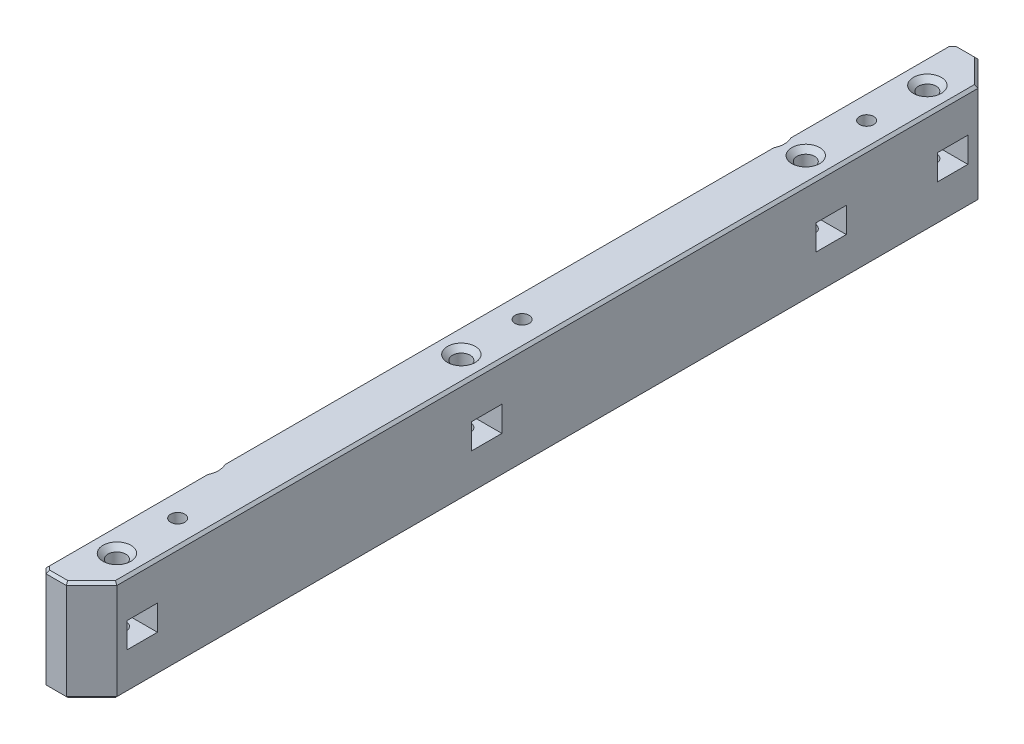
from build123d import *

# Parameters (mm, degrees)
SKETCH1_W           = 10
SKETCH1_H           = 20
BOSS_EXTRUDE1_DEPTH = 90
SKETCH6_R           = 1.75
CUT_EXTRUDE4_DEPTH  = 93.330926563
SKETCH7_R           = 1.4
CUT_EXTRUDE5_DEPTH  = 93.330926563
CUT_EXTRUDE6_START  = -10
CUT_EXTRUDE6_DEPTH  = 2.5
CHAMFER2_SIZE       = 5
CHAMFER3_SIZE       = 1
CHAMFER4_SIZE       = 0.5
CHAMFER5_SIZE       = 0.5
SKETCH10_R          = 3.75
CUT_EXTRUDE7_DEPTH  = 93.330926563


with BuildPart() as part:
    # Sketch1 → Boss-Extrude1 (new, symmetric)
    with BuildSketch(Plane.XY):
        Rectangle(SKETCH1_W, SKETCH1_H)
    extrude(amount=BOSS_EXTRUDE1_DEPTH, both=True)

    # Sketch6 → Cut-Extrude4 (cut, through all)
    with BuildSketch(Plane.XZ.offset(10)):
        with Locations((0, 80)):
            Circle(SKETCH6_R)
        with Locations((0, -80)):
            Circle(SKETCH6_R)
        with Locations((0, 12)):
            Circle(SKETCH6_R)
        with Locations((0, -56)):
            Circle(SKETCH6_R)
    extrude(amount=-CUT_EXTRUDE4_DEPTH, mode=Mode.SUBTRACT)

    # Sketch7 → Cut-Extrude5 (cut, through all)
    with BuildSketch(Plane(origin=(0, 10, 0), x_dir=(1, 0, 0), z_dir=(0, 1, 0))):
        with Locations(Location((0, 68, 0), (0, 0, 270))):
            Circle(SKETCH7_R)
        with Locations(Location((0, 0, 0), (0, 0, 270))):
            Circle(SKETCH7_R)
        with Locations(Location((0, -68, 0), (0, 0, 270))):
            Circle(SKETCH7_R)
    extrude(amount=-CUT_EXTRUDE5_DEPTH, mode=Mode.SUBTRACT)

    # Sketch9 → Cut-Extrude6 (cut, symmetric)
    with BuildSketch(Plane(origin=(0, 10, 0), x_dir=(1, 0, 0), z_dir=(0, 1, 0)).offset(CUT_EXTRUDE6_START)):
        Polygon((1.732050808, -77), (-1.732050808, -77), (-3.464101615, -80), (-1.732050808, -83), (1.732050808, -83), (12.756943772, -83), (12.756943772, -77), align=None)
        Polygon((-3.464101615, 80), (-1.732050808, 77), (1.732050808, 77), (12.756943772, 77), (12.756943772, 83), (1.732050808, 83), (-1.732050808, 83), align=None)
        Polygon((1.732050808, -9), (-1.732050808, -9), (-3.464101615, -12), (-1.732050808, -15), (1.732050808, -15), (12.756943772, -15), (12.756943772, -9), align=None)
        Polygon((1.732050808, 59), (-1.732050808, 59), (-3.464101615, 56), (-1.732050808, 53), (1.732050808, 53), (12.756943772, 53), (12.756943772, 59), align=None)
    extrude(amount=CUT_EXTRUDE6_DEPTH, both=True, mode=Mode.SUBTRACT)

    # Chamfer2
    chamfer2_edges = [part.edges().sort_by_distance(p)[0] for p in [
        (5, 0, 90),
        (5, 0, -90),
    ]]
    chamfer(chamfer2_edges, length=CHAMFER2_SIZE)

    # Chamfer3
    chamfer3_edges = [part.edges().sort_by_distance(p)[0] for p in [
        (-1.75, 10, 80),
        (-1.75, 10, -56),
        (-1.75, 10, 12),
        (-1.75, 10, -80),
        (-1.75, -10, -80),
        (0, -10, -1.4),
        (0, -10, 66.6),
        (-5, 0, 90),
        (-5, 0, -90),
    ]]
    chamfer(chamfer3_edges, length=CHAMFER3_SIZE)

    # Chamfer4
    chamfer4_edges = [part.edges().sort_by_distance(p)[0] for p in [
        (5, -10, 0),
        (2.5, -10, 87.5),
        (2.5, -10, -87.5),
        (-2, -10, -90),
        (-2, -10, 90),
        (-5, -10, 0),
        (-4.5, -10, 89.5),
        (-4.5, -10, -89.5),
    ]]
    chamfer(chamfer4_edges, length=CHAMFER4_SIZE)

    # Chamfer5
    chamfer5_edges = [part.edges().sort_by_distance(p)[0] for p in [
        (5, 10, 0),
        (-2, 10, -90),
        (-2, 10, 90),
        (2.5, 10, 87.5),
        (2.5, 10, -87.5),
        (-5, 10, 0),
        (-4.5, 10, 89.5),
        (-4.5, 10, -89.5),
    ]]
    chamfer(chamfer5_edges, length=CHAMFER5_SIZE)

    # Sketch10 → Cut-Extrude7 (cut, through all)
    with BuildSketch(Plane.XZ.offset(10)):
        with Locations((-7.848531477, -55.883586947)):
            Circle(SKETCH10_R)
        with Locations((-7.848531477, 55.883586947)):
            Circle(SKETCH10_R)
    extrude(amount=-CUT_EXTRUDE7_DEPTH, mode=Mode.SUBTRACT)


solid = part.part
